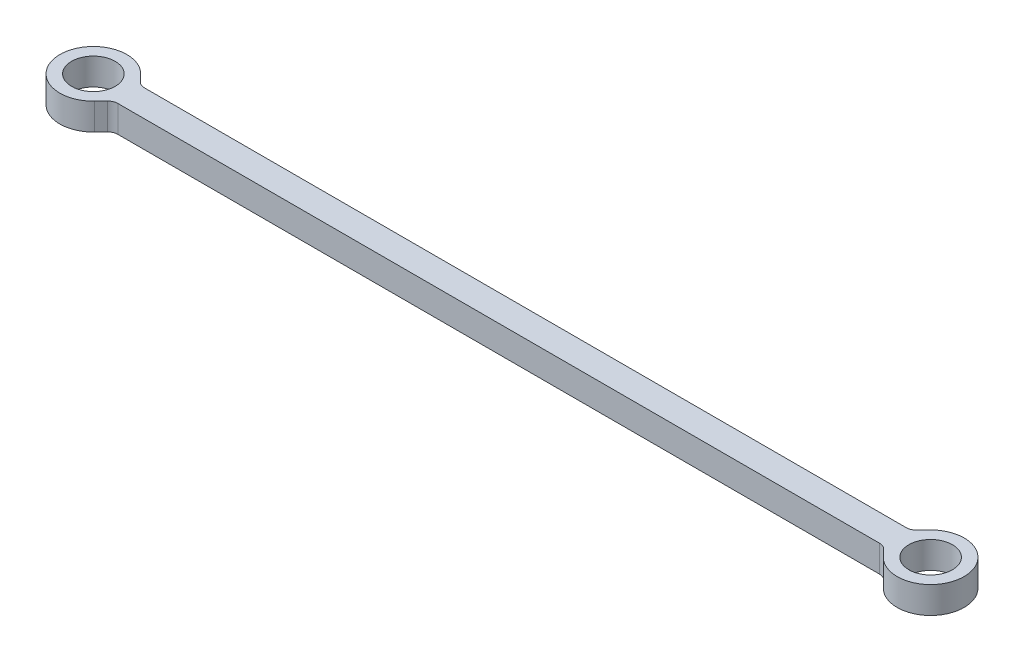
from build123d import *

# Parameters (mm, degrees)
SKETCH_1_R      = 6.5
EXTRUDE_1_DEPTH = 8


with BuildPart() as part:
    # Эскиз1 → Бобышка-Вытянуть1 (new body)
    with BuildSketch(Plane.XZ):
        with BuildLine():
            Line((7.24137931, -6.896551724), (9.113300493, -4.931034483))
            ThreePointArc((9.113300493, -4.931034483), (10.10395639, -4.24256491), (11.285714286, -4))
            Line((11.285714286, -4), (238.714285714, -4))
            ThreePointArc((238.714285714, -4), (239.89604361, -4.24256491), (240.886699507, -4.931034483))
            Line((240.886699507, -4.931034483), (242.75862069, -6.896551724))
            ThreePointArc((242.75862069, -6.896551724), (260, 0), (242.75862069, 6.896551724))
            Line((242.75862069, 6.896551724), (240.886699507, 4.931034483))
            ThreePointArc((240.886699507, 4.931034483), (239.89604361, 4.24256491), (238.714285714, 4))
            Line((238.714285714, 4), (11.285714286, 4))
            ThreePointArc((11.285714286, 4), (10.10395639, 4.24256491), (9.113300493, 4.931034483))
            Line((9.113300493, 4.931034483), (7.24137931, 6.896551724))
            ThreePointArc((7.24137931, 6.896551724), (-10, 0), (7.24137931, -6.896551724))
        make_face()
        with Locations(Location((0, 0, 0), (0, 0, 90))):
            Circle(SKETCH_1_R, mode=Mode.SUBTRACT)
        with Locations(Location((250, 0, 0), (0, 0, 90))):
            Circle(SKETCH_1_R, mode=Mode.SUBTRACT)
    extrude(amount=-EXTRUDE_1_DEPTH)


solid = part.part
